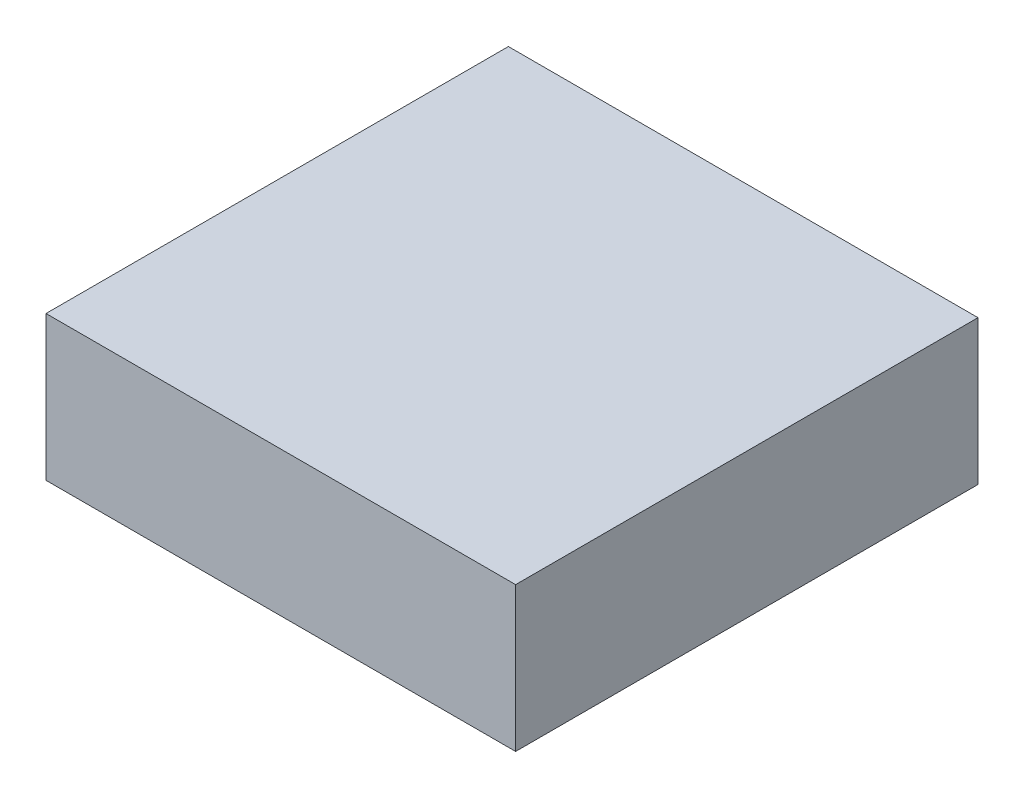
from build123d import *

# Parameters (mm, degrees)
IZIM1_W                     = 65
IZIM1_H                     = 64
Y_KSEKLIK_EKSTR_ZYON1_DEPTH = 20


with BuildPart() as part:
    # Çizim1 → Yükseklik-Ekstrüzyon1 (new body)
    with BuildSketch(Plane(origin=(0, 0, 0), x_dir=(1, 0, 0), z_dir=(0, 1, 0))):
        Rectangle(IZIM1_W, IZIM1_H)
    extrude(amount=Y_KSEKLIK_EKSTR_ZYON1_DEPTH)


solid = part.part
